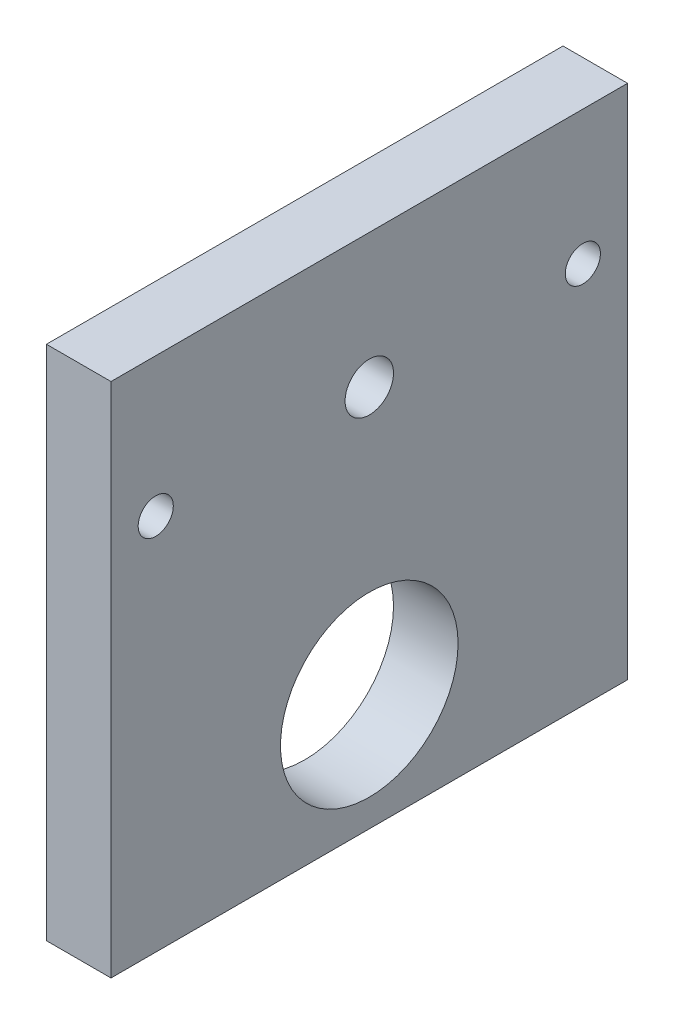
from build123d import *

# Parameters (mm, degrees)
SKETCH1_W                           = 50.8
SKETCH1_H                           = 50.8
BOSS_EXTRUDE1_DEPTH                 = 6.35
F_11_16_0_6875_DIAMETER_HOLE1_D     = 17.4625
F_11_16_0_6875_DIAMETER_HOLE1_DEPTH = 70.104
F_11_16_0_6875_DIAMETER_HOLE1_TIP   = 5.24626428
F_3_16_0_1875_DIAMETER_HOLE1_D      = 4.7625
F_3_16_0_1875_DIAMETER_HOLE1_DEPTH  = 70.104
F_3_16_0_1875_DIAMETER_HOLE1_TIP    = 1.430799349
F_29_0_136_DIAMETER_HOLE1_D         = 3.4544
F_29_0_136_DIAMETER_HOLE1_DEPTH     = 70.104
F_29_0_136_DIAMETER_HOLE1_TIP       = 1.037806461


with BuildPart() as part:
    # Sketch1 → Boss-Extrude1 (new body)
    with BuildSketch(Plane(origin=(0, 0, 0), x_dir=(0, 0, -1), z_dir=(1, 0, 0))):
        Rectangle(SKETCH1_W, SKETCH1_H)
    extrude(amount=BOSS_EXTRUDE1_DEPTH)

    # 11/16 (0.6875) Diameter Hole1
    with Locations(Plane(origin=(6.35, 0, 0), x_dir=(0, 0, -1), z_dir=(1, 0, 0))):
        with Locations((0, -13.97)):
            Hole(F_11_16_0_6875_DIAMETER_HOLE1_D / 2, depth=F_11_16_0_6875_DIAMETER_HOLE1_DEPTH)
            with Locations((0, 0, -(F_11_16_0_6875_DIAMETER_HOLE1_DEPTH + F_11_16_0_6875_DIAMETER_HOLE1_TIP / 2))):  # 118° drill point
                Cone(0, F_11_16_0_6875_DIAMETER_HOLE1_D / 2, F_11_16_0_6875_DIAMETER_HOLE1_TIP, mode=Mode.SUBTRACT)

    # 3/16 (0.1875) Diameter Hole1
    with Locations(Plane(origin=(6.35, 0, 0), x_dir=(0, 0, -1), z_dir=(1, 0, 0))):
        with Locations((0, 12.2301)):
            Hole(F_3_16_0_1875_DIAMETER_HOLE1_D / 2, depth=F_3_16_0_1875_DIAMETER_HOLE1_DEPTH)
            with Locations((0, 0, -(F_3_16_0_1875_DIAMETER_HOLE1_DEPTH + F_3_16_0_1875_DIAMETER_HOLE1_TIP / 2))):  # 118° drill point
                Cone(0, F_3_16_0_1875_DIAMETER_HOLE1_D / 2, F_3_16_0_1875_DIAMETER_HOLE1_TIP, mode=Mode.SUBTRACT)

    # #29 (0.136) Diameter Hole1
    with Locations(Plane(origin=(6.35, 0, 0), x_dir=(0, 0, -1), z_dir=(1, 0, 0))):
        with Locations((21, 12.2301), (-21, 11.74145915)):
            Hole(F_29_0_136_DIAMETER_HOLE1_D / 2, depth=F_29_0_136_DIAMETER_HOLE1_DEPTH)
            with Locations((0, 0, -(F_29_0_136_DIAMETER_HOLE1_DEPTH + F_29_0_136_DIAMETER_HOLE1_TIP / 2))):  # 118° drill point
                Cone(0, F_29_0_136_DIAMETER_HOLE1_D / 2, F_29_0_136_DIAMETER_HOLE1_TIP, mode=Mode.SUBTRACT)


solid = part.part
